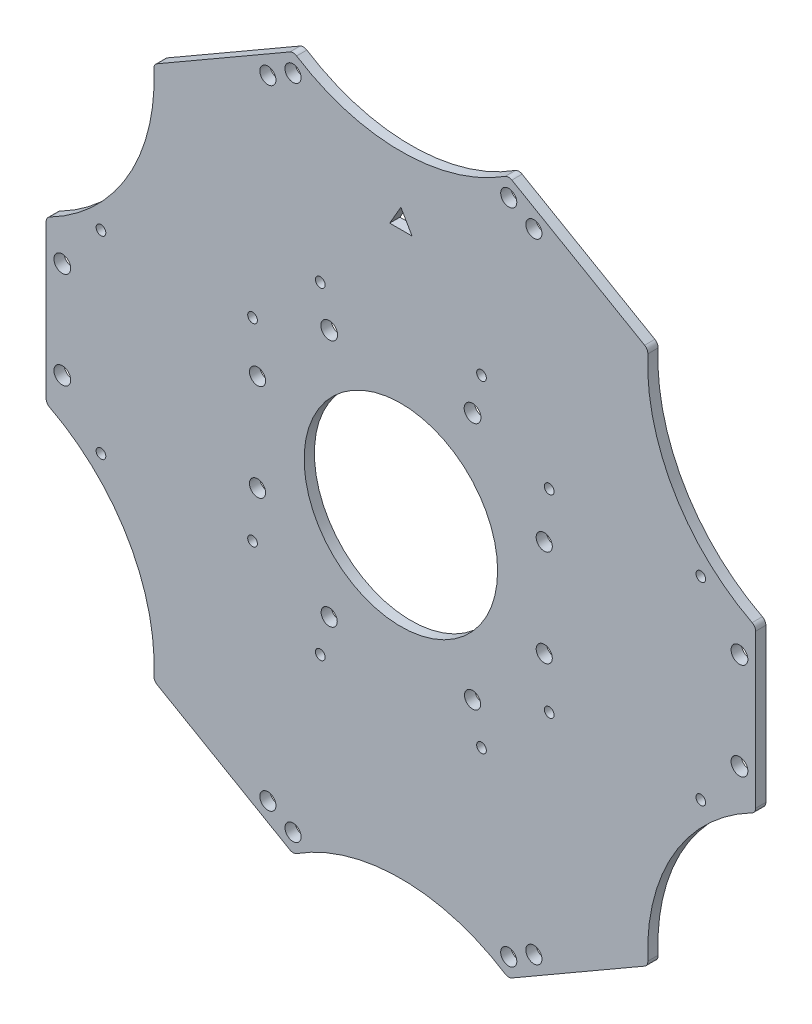
from build123d import *

# Parameters (mm, degrees)
SKETCH1_R           = 2.5
SKETCH1_R_2         = 2.6
SKETCH1_R_3         = 1.5
SKETCH1_R_4         = 30
BOSS_EXTRUDE1_DEPTH = 3.175
FILLET1_R           = 2


with BuildPart() as part:
    # Sketch1 → Boss-Extrude1 (new body)
    with BuildSketch(Plane.XY):
        with BuildLine():
            Line((-120, -25), (-120, 25))
            ThreePointArc((-120, 25), (-94.559451613, 48.820422151), (-86.650635095, 82.762794416))
            Line((-86.650635095, 82.762794416), (-43.349364905, 107.762794416))
            ThreePointArc((-43.349364905, 107.762794416), (-10, 97.640844302), (23.349364905, 107.762794416))
            Line((23.349364905, 107.762794416), (66.650635095, 82.762794416))
            ThreePointArc((66.650635095, 82.762794416), (74.559451613, 48.820422151), (100, 25))
            Line((100, 25), (100, -25))
            ThreePointArc((100, -25), (74.559451613, -48.820422151), (66.650635095, -82.762794416))
            Line((66.650635095, -82.762794416), (23.349364905, -107.762794416))
            ThreePointArc((23.349364905, -107.762794416), (-10, -97.640844302), (-43.349364905, -107.762794416))
            Line((-43.349364905, -107.762794416), (-86.650635095, -82.762794416))
            ThreePointArc((-86.650635095, -82.762794416), (-94.559451613, -48.820422151), (-120, -25))
        make_face()
        with Locations((12.227985364, -38.5)):
            Circle(SKETCH1_R, mode=Mode.SUBTRACT)
        with Locations((-54.455970728, 15)):
            Circle(SKETCH1_R, mode=Mode.SUBTRACT)
        with Locations((12.227985364, 38.5)):
            Circle(SKETCH1_R_2, mode=Mode.SUBTRACT)
        with Locations((-32.227985364, 38.5)):
            Circle(SKETCH1_R_2, mode=Mode.SUBTRACT)
        with Locations((-54.455970728, -15)):
            Circle(SKETCH1_R, mode=Mode.SUBTRACT)
        with Locations((-32.227985364, -38.5)):
            Circle(SKETCH1_R, mode=Mode.SUBTRACT)
        with Locations((95, 15)):
            Circle(SKETCH1_R_2, mode=Mode.SUBTRACT)
        with Locations((95, -15)):
            Circle(SKETCH1_R_2, mode=Mode.SUBTRACT)
        with Locations((-115, -15)):
            Circle(SKETCH1_R_2, mode=Mode.SUBTRACT)
        with Locations((-115, 15)):
            Circle(SKETCH1_R_2, mode=Mode.SUBTRACT)
        with Locations((31.241669751, -97.432667397)):
            Circle(SKETCH1_R, mode=Mode.SUBTRACT)
        with Locations((23.447441117, -101.932667397)):
            Circle(SKETCH1_R, mode=Mode.SUBTRACT)
        with Locations((-43.447441117, -101.932667397)):
            Circle(SKETCH1_R, mode=Mode.SUBTRACT)
        with Locations((-51.241669751, -97.432667397)):
            Circle(SKETCH1_R, mode=Mode.SUBTRACT)
        with Locations((-51.241669751, 97.432667397)):
            Circle(SKETCH1_R, mode=Mode.SUBTRACT)
        with Locations((-43.447441117, 101.932667397)):
            Circle(SKETCH1_R, mode=Mode.SUBTRACT)
        with Locations((23.447441117, 101.932667397)):
            Circle(SKETCH1_R, mode=Mode.SUBTRACT)
        with Locations((31.241669751, 97.432667397)):
            Circle(SKETCH1_R, mode=Mode.SUBTRACT)
        with Locations((34.455970728, -15)):
            Circle(SKETCH1_R, mode=Mode.SUBTRACT)
        with Locations((34.455970728, 15)):
            Circle(SKETCH1_R, mode=Mode.SUBTRACT)
        with Locations((-103, 30)):
            Circle(SKETCH1_R_3, mode=Mode.SUBTRACT)
        with Locations((-56, 30)):
            Circle(SKETCH1_R_3, mode=Mode.SUBTRACT)
        with Locations((-56, -30)):
            Circle(SKETCH1_R_3, mode=Mode.SUBTRACT)
        with Locations((-103, -30)):
            Circle(SKETCH1_R_3, mode=Mode.SUBTRACT)
        with Locations((36, 30)):
            Circle(SKETCH1_R_3, mode=Mode.SUBTRACT)
        with Locations((36, -30)):
            Circle(SKETCH1_R_3, mode=Mode.SUBTRACT)
        with Locations((83, 30)):
            Circle(SKETCH1_R_3, mode=Mode.SUBTRACT)
        with Locations((83, -30)):
            Circle(SKETCH1_R_3, mode=Mode.SUBTRACT)
        with Locations((-35, 50)):
            Circle(SKETCH1_R_3, mode=Mode.SUBTRACT)
        with Locations((15, 50)):
            Circle(SKETCH1_R_3, mode=Mode.SUBTRACT)
        with Locations((15, -50)):
            Circle(SKETCH1_R_3, mode=Mode.SUBTRACT)
        with Locations((-35, -50)):
            Circle(SKETCH1_R_3, mode=Mode.SUBTRACT)
        with Locations((-10, 0)):
            Circle(SKETCH1_R_4, mode=Mode.SUBTRACT)
        Polygon((-10, 82.640844302), (-13.464101615, 76.640844302), (-6.535898385, 76.640844302), align=None, mode=Mode.SUBTRACT)
    extrude(amount=BOSS_EXTRUDE1_DEPTH)

    # Fillet1
    fillet1_edges = [part.edges().sort_by_distance(p)[0] for p in [
        (-120, -25, 1.5875),
        (-120, 25, 1.5875),
        (-86.650635095, 82.762794416, 1.5875),
        (-43.349364905, 107.762794416, 1.5875),
        (23.349364905, 107.762794416, 1.5875),
        (66.650635095, 82.762794416, 1.5875),
        (100, 25, 1.5875),
        (100, -25, 1.5875),
        (66.650635095, -82.762794416, 1.5875),
        (23.349364905, -107.762794416, 1.5875),
        (-43.349364905, -107.762794416, 1.5875),
        (-86.650635095, -82.762794416, 1.5875),
    ]]
    fillet(fillet1_edges, radius=FILLET1_R)


solid = part.part
